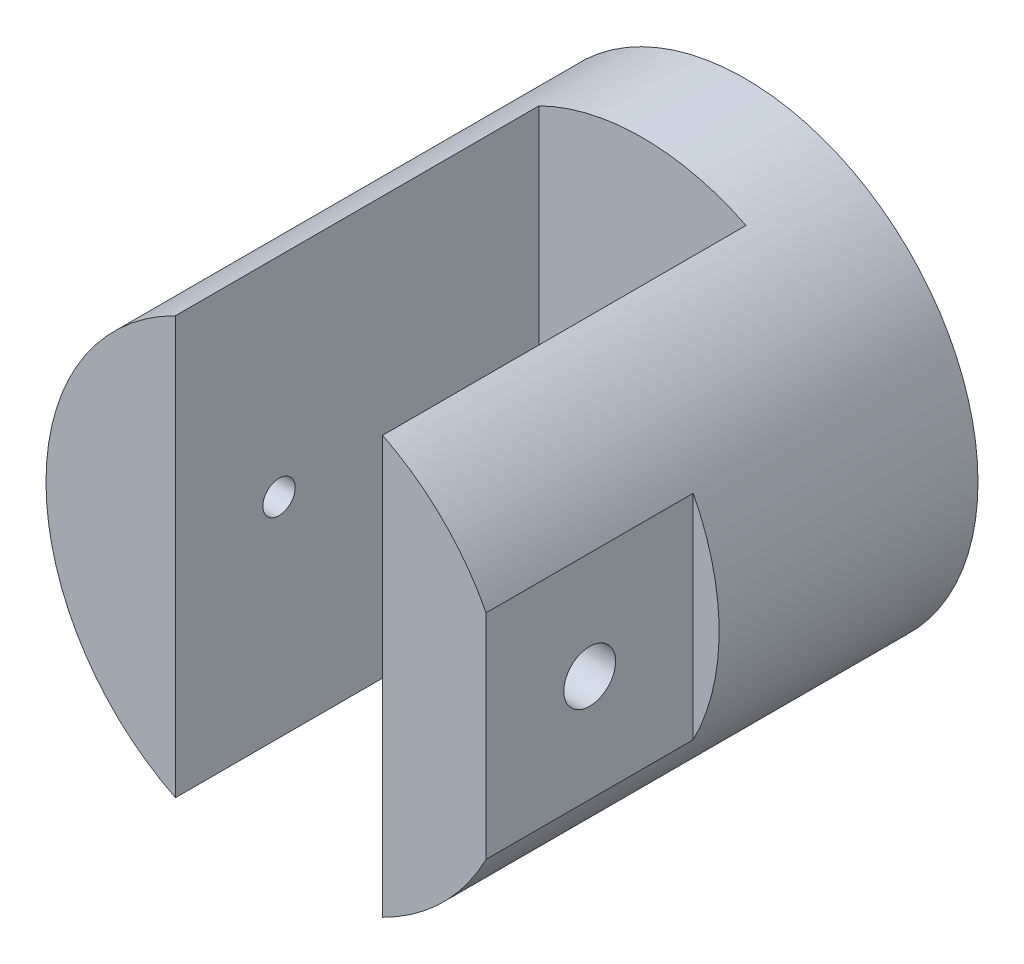
from build123d import *

# Parameters (mm, degrees)
SKETCH1_R                   = 28.575
OD_DON_T_CARE_DEPTH         = 57.15
SKETCH3_W                   = 25.4
SKETCH3_H                   = 44.577
SLOT_DEPTH                  = 50.8
SKETCH4_R                   = 7.9375
F_5_8_THROUGH_HOLE_DEPTH    = 61.167850045
SKETCH5_OUTSIDE_W           = 78.948
SKETCH5_OUTSIDE_H           = 78.948
SKETCH5_OUTSIDE_W_2         = 53.975
SKETCH5_OUTSIDE_H_2         = 51.195336702
FLAT_SURFACE_DEPTH          = 25.4
SKETCH2_R                   = 3.175
F_1_4_THROUGH_HOLE_DEPTH    = 38.1
SKETCH7_R                   = 1.984375
F_10_32_THREADED_HOLE_DEPTH = 77.067593297


with BuildPart() as part:
    # Sketch1 → OD Don't Care (new body)
    with BuildSketch(Plane.XY):
        Circle(SKETCH1_R)
    extrude(amount=OD_DON_T_CARE_DEPTH)

    # Sketch3 → Slot (cut, symmetric)
    with BuildSketch(Plane(origin=(0, 0, 0), x_dir=(1, 0, 0), z_dir=(0, 1, 0))):
        with Locations((0, -34.8615)):
            Rectangle(SKETCH3_W, SKETCH3_H)
    extrude(amount=SLOT_DEPTH, both=True, mode=Mode.SUBTRACT)

    # Sketch4 → 5/8" Through Hole (cut, through all)
    with BuildSketch(Plane.XY.offset(12.573)):
        Circle(SKETCH4_R)
    extrude(amount=-F_5_8_THROUGH_HOLE_DEPTH, mode=Mode.SUBTRACT)

    # Sketch5 outside → Flat Surface (cut)
    with BuildSketch(Plane.XY.offset(57.15)):
        Rectangle(SKETCH5_OUTSIDE_W, SKETCH5_OUTSIDE_H)
        with Locations((-1.5875, 0)):
            Rectangle(SKETCH5_OUTSIDE_W_2, SKETCH5_OUTSIDE_H_2, mode=Mode.SUBTRACT)
    extrude(amount=-FLAT_SURFACE_DEPTH, mode=Mode.SUBTRACT)

    # Sketch2 → 1/4" Through Hole (cut)
    with BuildSketch(Plane(origin=(25.4, 0, 0), x_dir=(0, 0, -1), z_dir=(1, 0, 0))):
        with Locations((-44.45, 0)):
            Circle(SKETCH2_R)
    extrude(amount=-F_1_4_THROUGH_HOLE_DEPTH, mode=Mode.SUBTRACT)

    # Sketch7 → 10-32 Threaded Hole (cut, through all)
    with BuildSketch(Plane(origin=(-12.7, 0, 0), x_dir=(0, 0, -1), z_dir=(1, 0, 0))):
        with Locations((-44.45, 0)):
            Circle(SKETCH7_R)
    extrude(amount=-F_10_32_THREADED_HOLE_DEPTH, mode=Mode.SUBTRACT)


solid = part.part
